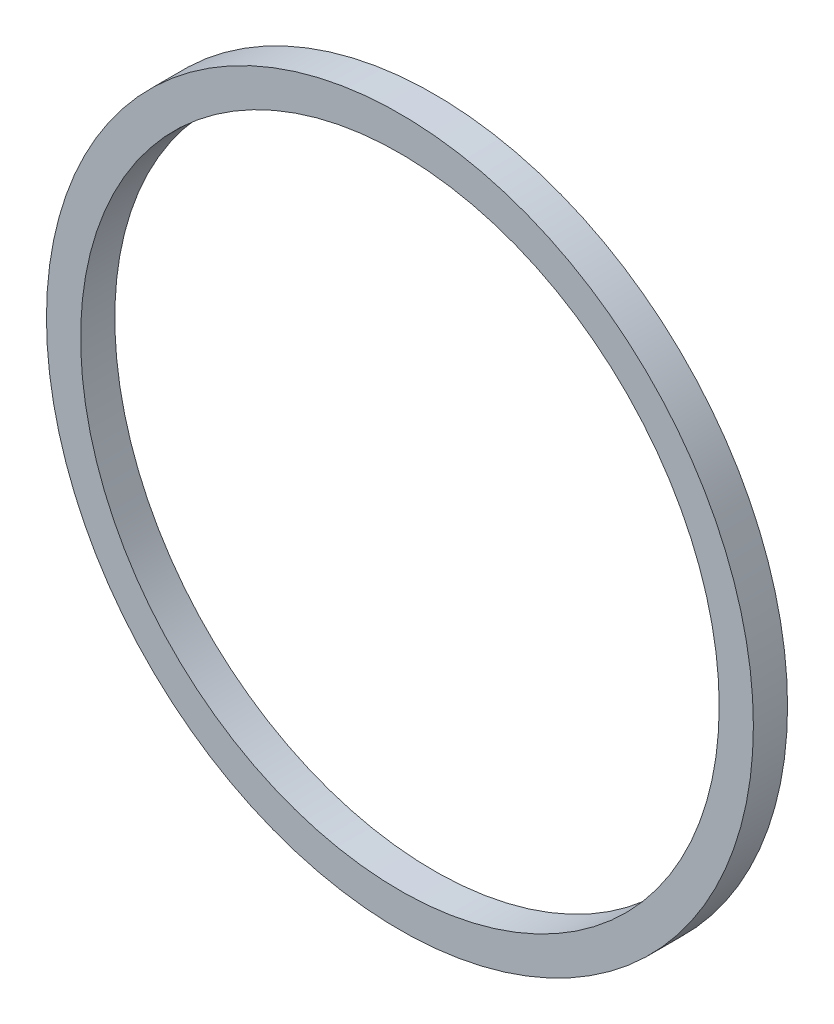
from build123d import *

# Parameters (mm, degrees)
SKETCH2_W = 2.6162
SKETCH2_H = 2.6162


with BuildPart() as part:
    # Sketch2 → Revolve1 (revolve)
    with BuildSketch(Plane(origin=(0, 0, 0), x_dir=(1, 0, 0), z_dir=(0, 1, 0)), mode=Mode.PRIVATE) as revolve1_sk:
        with Locations((-25.7556, 0)):
            Rectangle(SKETCH2_W, SKETCH2_H)
    revolve(revolve1_sk.sketch.rotate(Axis((0, 0, 1.3081), (0, 0, -1)), 180), axis=Axis((0, 0, 1.3081), (0, 0, -1)))


solid = part.part
